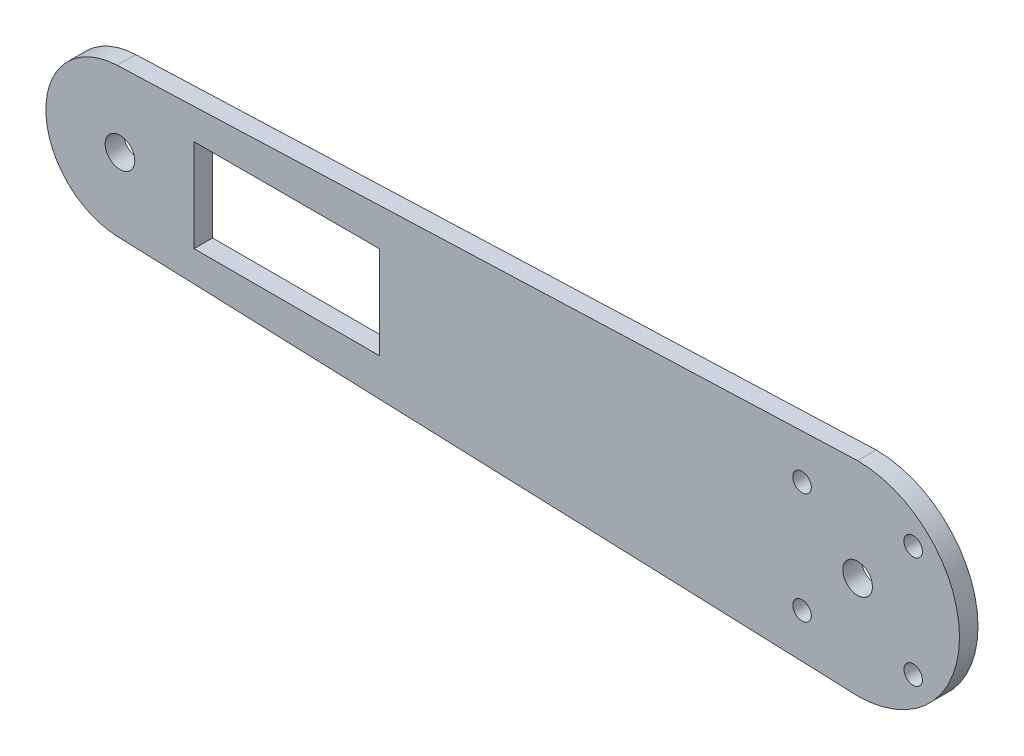
from build123d import *

# Parameters (mm, degrees)
SKETCH1_R           = 2.5
SKETCH1_R_2         = 4
SKETCH1_W           = 50
SKETCH1_H           = 25
BOSS_EXTRUDE1_DEPTH = 5


with BuildPart() as part:
    # Sketch1 → Boss-Extrude1 (new body)
    with BuildSketch(Plane.XY):
        with BuildLine():
            Line((0, 27.5), (-199.858795136, 19.985879514))
            ThreePointArc((-199.858795136, 19.985879514), (-219.107383088, 0), (-199.858795136, -19.985879514))
            Line((-199.858795136, -19.985879514), (0, -27.5))
            ThreePointArc((0, -27.5), (27.5, 0), (0, 27.5))
        make_face()
        with Locations((-15, -15)):
            Circle(SKETCH1_R, mode=Mode.SUBTRACT)
        with Locations((15, 15)):
            Circle(SKETCH1_R, mode=Mode.SUBTRACT)
        with Locations((15, -15)):
            Circle(SKETCH1_R, mode=Mode.SUBTRACT)
        with Locations((-15, 15)):
            Circle(SKETCH1_R, mode=Mode.SUBTRACT)
        Circle(SKETCH1_R_2, mode=Mode.SUBTRACT)
        with Locations((-199.107383088, 0)):
            Circle(SKETCH1_R_2, mode=Mode.SUBTRACT)
        with Locations((-154.107383088, 0)):
            Rectangle(SKETCH1_W, SKETCH1_H, mode=Mode.SUBTRACT)
    extrude(amount=BOSS_EXTRUDE1_DEPTH)


solid = part.part
